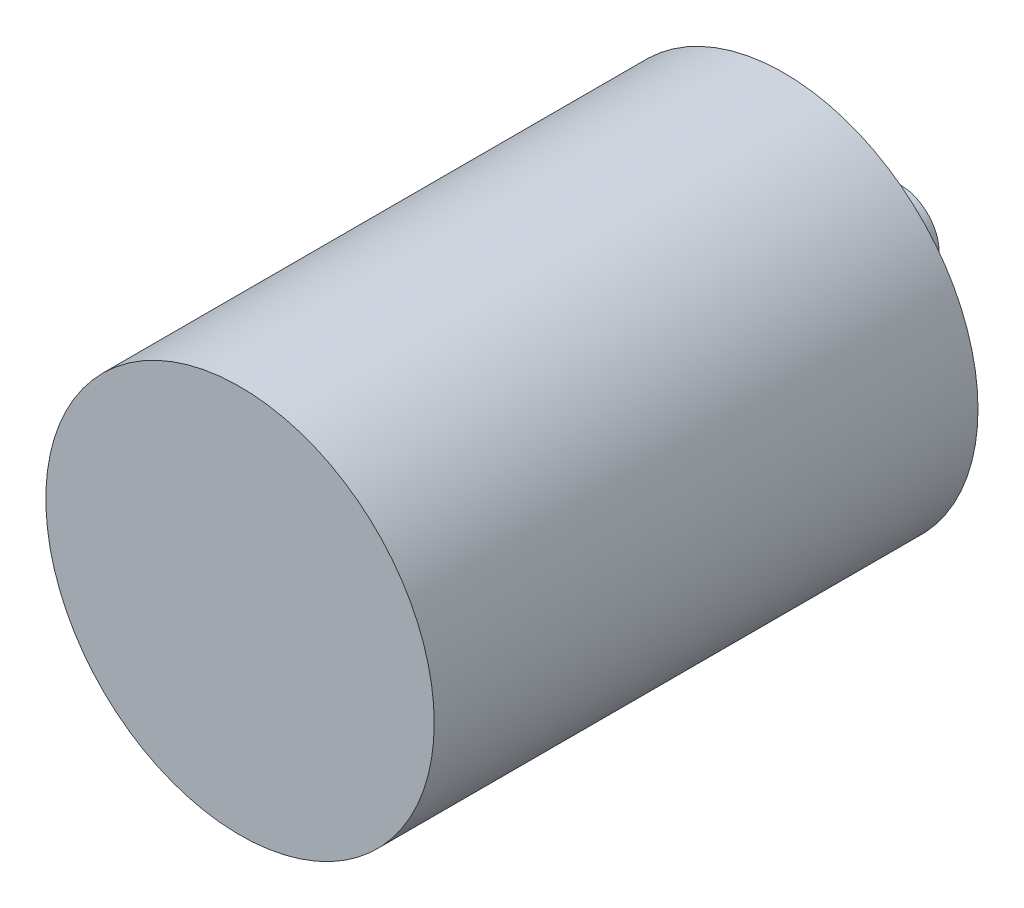
from build123d import *

# Parameters (mm, degrees)
SKETCH1_R           = 10
BOSS_EXTRUDE1_DEPTH = 28
SKETCH2_R           = 2
BOSS_EXTRUDE2_DEPTH = 6


with BuildPart() as part:
    # Sketch1 → Boss-Extrude1 (new body)
    with BuildSketch(Plane.XY):
        Circle(SKETCH1_R)
    extrude(amount=BOSS_EXTRUDE1_DEPTH)

    # Sketch2 → Boss-Extrude2 (add)
    with BuildSketch(Plane(origin=(0, 0, 0), x_dir=(-1, 0, 0), z_dir=(0, 0, -1))):
        Circle(SKETCH2_R)
    extrude(amount=BOSS_EXTRUDE2_DEPTH)


solid = part.part
